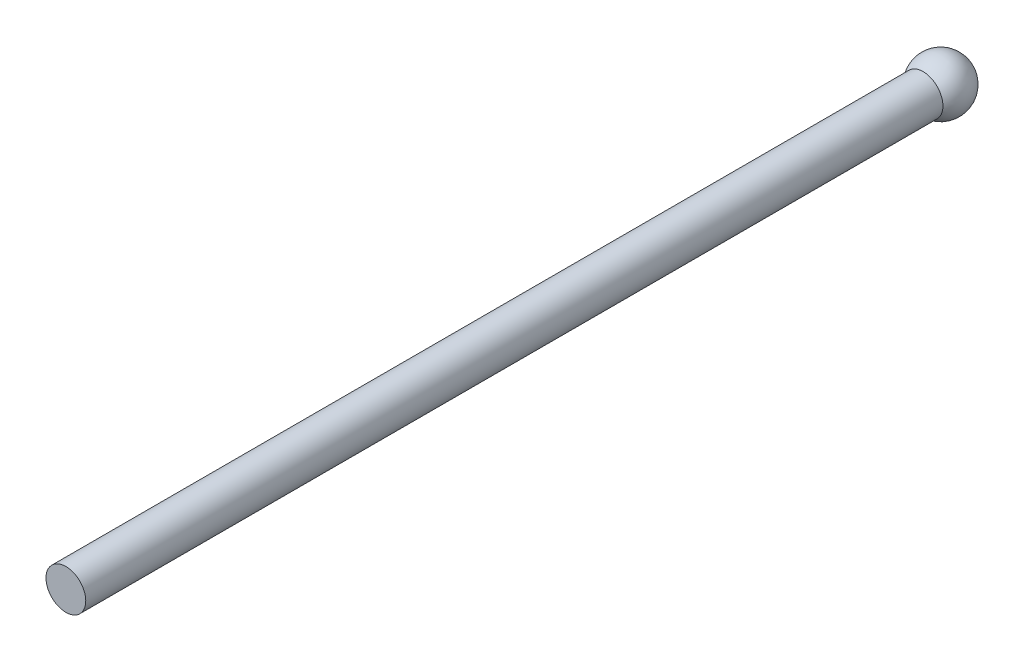
from build123d import *

# Parameters (mm, degrees)
SKETCH1_R           = 7.5
BOSS_EXTRUDE1_DEPTH = 330


with BuildPart() as part:
    # Sketch1 → Boss-Extrude1 (new body)
    with BuildSketch(Plane.XY):
        Circle(SKETCH1_R)
    extrude(amount=BOSS_EXTRUDE1_DEPTH)

    # Sketch2 → Revolve1 (revolve)
    with BuildSketch(Plane(origin=(0, 0, 0), x_dir=(1, 0, 0), z_dir=(0, 1, 0))):
        with BuildLine():
            Line((-7.5, -6.614378278), (0, -6.614378278))
            Line((0, -6.614378278), (0, 10))
            ThreePointArc((0, 10), (-9.114378278, 4.114378278), (-7.5, -6.614378278))
        make_face()
    revolve(axis=Axis((0, 0, 0), (0, 0, -1)))


solid = part.part
